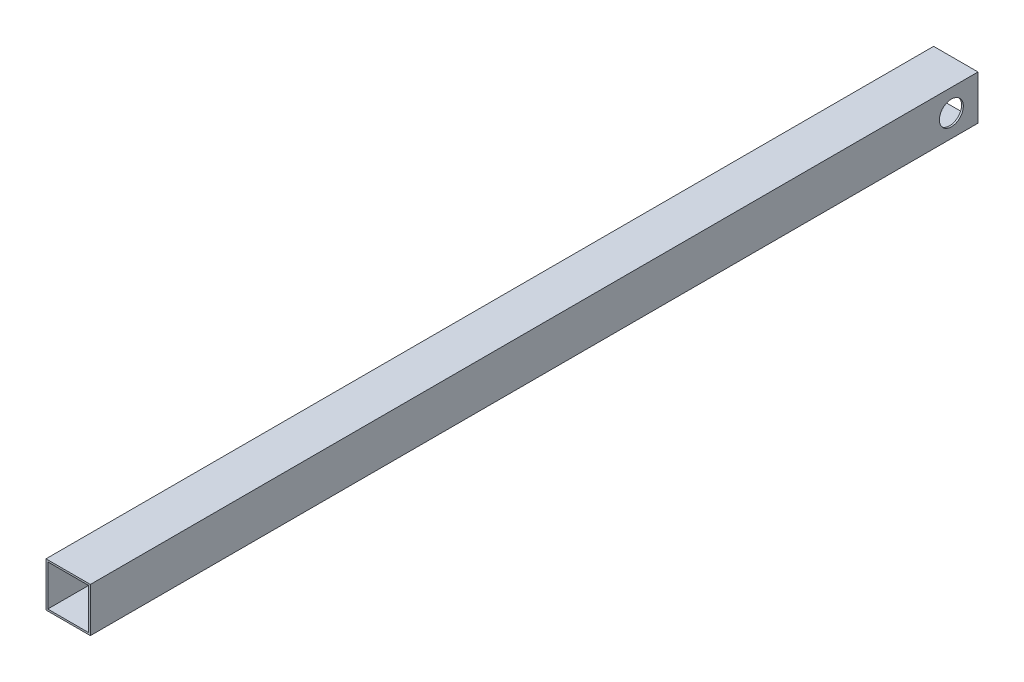
from build123d import *

# Parameters (mm, degrees)
SKETCH1_W           = 25
SKETCH1_H           = 25
BOSS_EXTRUDE1_DEPTH = 500
SKETCH2_W           = 23
SKETCH2_H           = 23
CUT_EXTRUDE1_DEPTH  = 501.312402405
SKETCH3_R           = 6.75
CUT_EXTRUDE2_DEPTH  = 501.7806406


with BuildPart() as part:
    # Sketch1 → Boss-Extrude1 (new body)
    with BuildSketch(Plane.XY):
        Rectangle(SKETCH1_W, SKETCH1_H)
    extrude(amount=BOSS_EXTRUDE1_DEPTH)

    # Sketch2 → Cut-Extrude1 (cut, through all)
    with BuildSketch(Plane.XY.offset(500)):
        Rectangle(SKETCH2_W, SKETCH2_H)
    extrude(amount=-CUT_EXTRUDE1_DEPTH, mode=Mode.SUBTRACT)

    # Sketch3 → Cut-Extrude2 (cut, through all)
    with BuildSketch(Plane(origin=(12.5, 0, 0), x_dir=(0, 0, -1), z_dir=(1, 0, 0))):
        with Locations(Location((-15, 0, 0), (0, 0, 90))):
            Circle(SKETCH3_R)
    extrude(amount=-CUT_EXTRUDE2_DEPTH, mode=Mode.SUBTRACT)


solid = part.part
